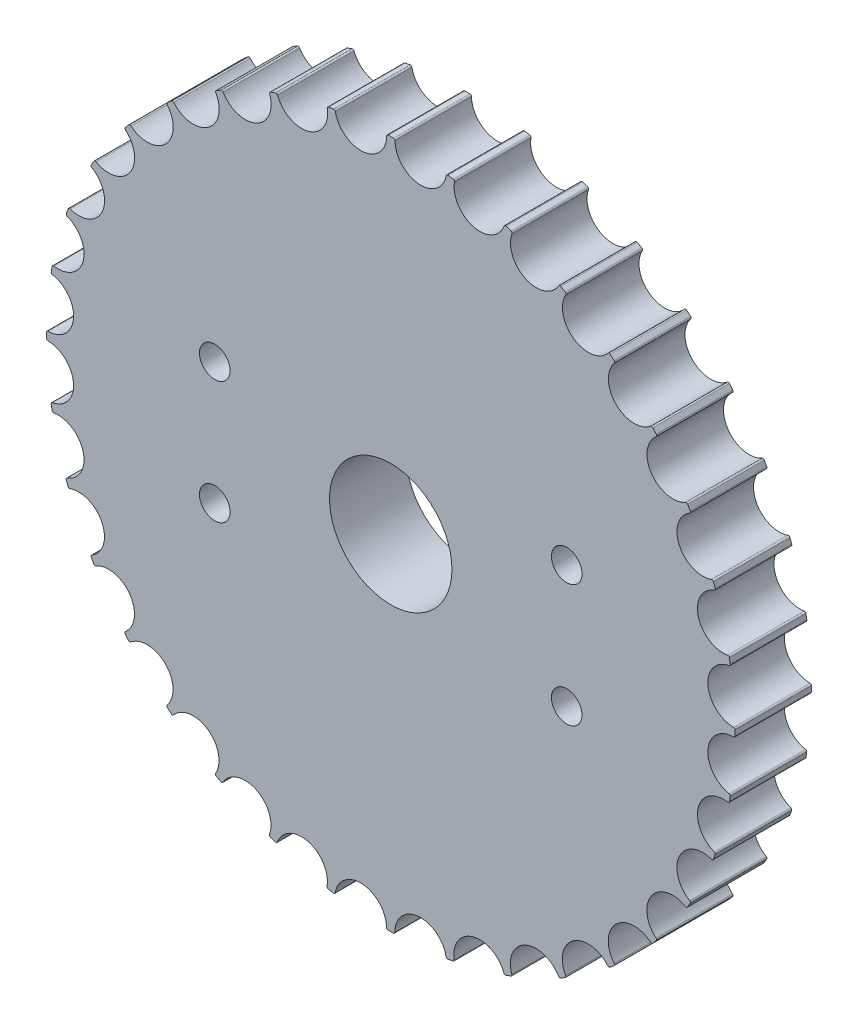
from build123d import *

# Parameters (mm, degrees)
SKETCH_1_R          = 45
EXTRUDE_1_DEPTH     = 10
SKETCH_2_R          = 3.38
CUT_EXTRUDE_2_DEPTH = 50
FILLET_1_R          = 0.2
SKETCH_4_R          = 8
CUT_EXTRUDE_3_DEPTH = 10
SKETCH_5_R          = 2
CUT_EXTRUDE_4_DEPTH = 10


with BuildPart() as part:
    # 스케치1 → 보스-돌출1 (new body)
    with BuildSketch(Plane.XY):
        Circle(SKETCH_1_R)
    extrude(amount=EXTRUDE_1_DEPTH)

    # 스케치2 → 컷-돌출2 (cut)
    with BuildSketch(Plane.XY.offset(10)):
        with Locations((3.93571055, 44.827560523)):
            Circle(SKETCH_2_R)
        with Locations((11.660142457, 43.463100187)):
            Circle(SKETCH_2_R)
        with Locations((19.030286837, 40.778035545)):
            Circle(SKETCH_2_R)
        with Locations((25.82220558, 36.853950928)):
            Circle(SKETCH_2_R)
        with Locations((31.829529673, 31.81007766)):
            Circle(SKETCH_2_R)
        with Locations((36.869729614, 25.79967128)):
            Circle(SKETCH_2_R)
        with Locations((40.789661478, 19.005354943)):
            Circle(SKETCH_2_R)
        with Locations((43.470220118, 11.633570514)):
            Circle(SKETCH_2_R)
        with Locations((44.829958117, 3.908305931)):
            Circle(SKETCH_2_R)
        with Locations((44.827560523, -3.93571055)):
            Circle(SKETCH_2_R)
        with Locations((43.463100187, -11.660142457)):
            Circle(SKETCH_2_R)
        with Locations((40.778035545, -19.030286837)):
            Circle(SKETCH_2_R)
        with Locations((36.853950928, -25.82220558)):
            Circle(SKETCH_2_R)
        with Locations((31.81007766, -31.829529673)):
            Circle(SKETCH_2_R)
        with Locations((25.79967128, -36.869729614)):
            Circle(SKETCH_2_R)
        with Locations((19.005354943, -40.789661478)):
            Circle(SKETCH_2_R)
        with Locations((11.633570514, -43.470220118)):
            Circle(SKETCH_2_R)
        with Locations((3.908305931, -44.829958117)):
            Circle(SKETCH_2_R)
        with Locations((-3.93571055, -44.827560523)):
            Circle(SKETCH_2_R)
        with Locations((-11.660142457, -43.463100187)):
            Circle(SKETCH_2_R)
        with Locations((-19.030286837, -40.778035545)):
            Circle(SKETCH_2_R)
        with Locations((-25.82220558, -36.853950928)):
            Circle(SKETCH_2_R)
        with Locations((-31.829529673, -31.81007766)):
            Circle(SKETCH_2_R)
        with Locations((-36.869729614, -25.79967128)):
            Circle(SKETCH_2_R)
        with Locations((-40.789661478, -19.005354943)):
            Circle(SKETCH_2_R)
        with Locations((-43.470220118, -11.633570514)):
            Circle(SKETCH_2_R)
        with Locations((-44.829958117, -3.908305931)):
            Circle(SKETCH_2_R)
        with Locations((-44.827560523, 3.93571055)):
            Circle(SKETCH_2_R)
        with Locations((-43.463100187, 11.660142457)):
            Circle(SKETCH_2_R)
        with Locations((-40.778035545, 19.030286837)):
            Circle(SKETCH_2_R)
        with Locations((-36.853950928, 25.82220558)):
            Circle(SKETCH_2_R)
        with Locations((-31.81007766, 31.829529673)):
            Circle(SKETCH_2_R)
        with Locations((-25.79967128, 36.869729614)):
            Circle(SKETCH_2_R)
        with Locations((-19.005354943, 40.789661478)):
            Circle(SKETCH_2_R)
        with Locations((-11.633570514, 43.470220118)):
            Circle(SKETCH_2_R)
        with Locations((-3.908305931, 44.829958117)):
            Circle(SKETCH_2_R)
    extrude(amount=-CUT_EXTRUDE_2_DEPTH, mode=Mode.SUBTRACT)

    # 필렛1
    fillet_1_edges = [part.edges().sort_by_distance(p)[0] for p in [
        (44.996850108, 0.532428702, 5),
        (44.410149891, 7.262133752, 5),
        (44.220791574, 8.337960936, 5),
        (42.474403633, 14.863547221, 5),
        (42.101106664, 15.890148446, 5),
        (39.248094114, 22.013339329, 5),
        (38.702200933, 22.959521836, 5),
        (34.829251116, 28.49426726, 5),
        (28.515553676, 34.811825556, 5),
        (22.983176889, 38.688158138, 5),
        (34.127348411, 29.331281773, 5),
        (29.352138947, 34.1094113, 5),
        (22.037328273, 39.234629635, 5),
        (15.915882631, 42.091384868, 5),
        (14.889509801, 42.465309346, 5),
        (8.364992333, 44.215686168, 5),
        (8.337960936, -44.220791574, 5),
        (14.863547221, -42.474403633, 5),
        (15.890148446, -42.101106664, 5),
        (22.013339329, -39.248094114, 5),
        (29.331281773, -34.127348411, 5),
        (34.1094113, -29.352138947, 5),
        (22.959521836, -38.702200933, 5),
        (28.49426726, -34.829251116, 5),
        (34.811825556, -28.515553676, 5),
        (38.688158138, -22.983176889, 5),
        (39.234629635, -22.037328273, 5),
        (42.091384868, -15.915882631, 5),
        (42.465309346, -14.889509801, 5),
        (44.215686168, -8.364992333, 5),
        (44.405702122, -7.289281108, 5),
        (44.996516217, -0.559935976, 5),
        (0.532428702, -44.996850108, 5),
        (7.262133752, -44.410149891, 5),
        (-7.289281108, -44.405702122, 5),
        (-0.559935976, -44.996516217, 5),
        (-14.889509801, -42.465309346, 5),
        (-8.364992333, -44.215686168, 5),
        (-22.037328273, -39.234629635, 5),
        (-15.915882631, -42.091384868, 5),
        (-42.101106664, -15.890148446, 5),
        (-39.248094114, -22.013339329, 5),
        (-38.702200933, -22.959521836, 5),
        (-34.829251116, -28.49426726, 5),
        (-28.515553676, -34.811825556, 5),
        (-22.983176889, -38.688158138, 5),
        (-34.127348411, -29.331281773, 5),
        (-29.352138947, -34.1094113, 5),
        (-44.220791574, -8.337960936, 5),
        (-42.474403633, -14.863547221, 5),
        (-44.996850108, -0.532428702, 5),
        (-44.410149891, -7.262133752, 5),
        (-44.405702122, 7.289281108, 5),
        (-44.996516217, 0.559935976, 5),
        (-42.465309346, 14.889509801, 5),
        (-44.215686168, 8.364992333, 5),
        (-29.331281773, 34.127348411, 5),
        (-34.1094113, 29.352138947, 5),
        (-22.959521836, 38.702200933, 5),
        (-28.49426726, 34.829251116, 5),
        (-34.811825556, 28.515553676, 5),
        (-38.688158138, 22.983176889, 5),
        (-39.234629635, 22.037328273, 5),
        (-42.091384868, 15.915882631, 5),
        (-15.890148446, 42.101106664, 5),
        (-22.013339329, 39.248094114, 5),
        (-8.337960936, 44.220791574, 5),
        (-14.863547221, 42.474403633, 5),
        (-0.532428702, 44.996850108, 5),
        (-7.262133752, 44.410149891, 5),
        (7.289281108, 44.405702122, 5),
        (0.559935976, 44.996516217, 5),
    ]]
    fillet(fillet_1_edges, radius=FILLET_1_R)

    # 스케치4 → 컷-돌출3 (cut)
    with BuildSketch(Plane.XY.offset(10)):
        Circle(SKETCH_4_R)
    extrude(amount=-CUT_EXTRUDE_3_DEPTH, mode=Mode.SUBTRACT)

    # 스케치5 → 컷-돌출4 (cut)
    with BuildSketch(Plane.XY.offset(10)):
        with Locations((-23, 8)):
            Circle(SKETCH_5_R)
        with Locations(Location((23, 8, 0), (0, 0, 180))):
            Circle(SKETCH_5_R)
        with Locations((23, -8)):
            Circle(SKETCH_5_R)
        with Locations(Location((-23, -8, 0), (0, 0, 180))):
            Circle(SKETCH_5_R)
    extrude(amount=-CUT_EXTRUDE_4_DEPTH, mode=Mode.SUBTRACT)


solid = part.part
